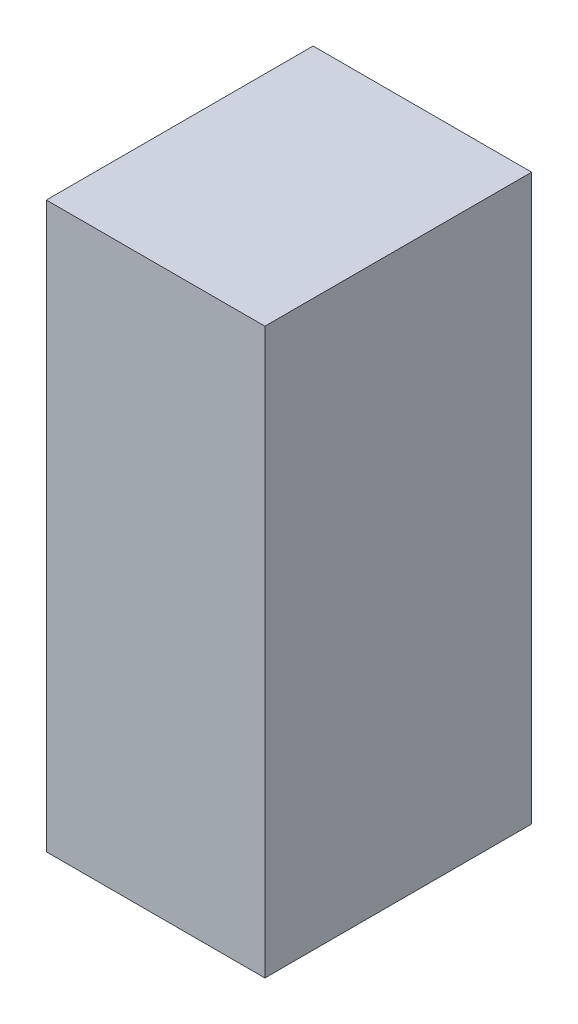
from build123d import *

# Parameters (mm, degrees)
ESBO_O1_W                = 18.022976322
ESBO_O1_H                = 46.556482914
RESSALTO_EXTRUS_O1_DEPTH = 22


with BuildPart() as part:
    # Esboço1 → Ressalto-extrusão1 (new body)
    with BuildSketch(Plane.XY):
        with Locations((9.011488161, 23.278241457)):
            Rectangle(ESBO_O1_W, ESBO_O1_H)
    extrude(amount=RESSALTO_EXTRUS_O1_DEPTH)


solid = part.part
